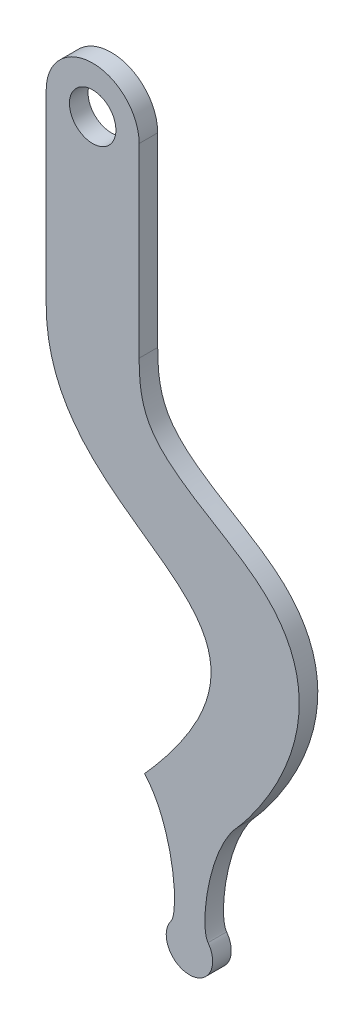
from build123d import *

# Parameters (mm, degrees)
CROQUIS1_R              = 0.25
SALIENTE_EXTRUIR1_DEPTH = 0.2


with BuildPart() as part:
    # Croquis1 → Saliente-Extruir1 (new body)
    with BuildSketch(Plane.XY):
        with BuildLine():
            Line((-0.953049545, -0.258041218), (-0.953049545, -2.258041218))
            add(Edge.make_bspline(
                [(-0.953049545, -2.258041218), (-0.953049545, -2.777596153), (-0.792723594, -3.039794493), (1.611557074, -4.393344835), (0.148079669, -6.054927281), (0.105412555, -6.100480554)],
                knots=[0, 0, 0, 0, 0.302759369, 0.402759369, 1, 1, 1, 1], degree=3))
            add(Edge.make_bspline(
                [(-0.211679745, -7.333949248), (-0.302912235, -7.212305928), (-0.211828565, -6.439181016), (0.105412555, -6.100480554)],
                knots=[0, 0, 0, 0, 1, 1, 1, 1], degree=3))
            ThreePointArc((-0.211679745, -7.333949248), (-0.411679745, -7.733949248), (-0.611679745, -7.333949248))
            add(Edge.make_bspline(
                [(-0.611679745, -7.333949248), (-0.51667907, -7.207281682), (-0.584931115, -6.434344759), (-0.894587445, -6.100480554)],
                knots=[0, 0, 0, 0, 1, 1, 1, 1], degree=3))
            add(Edge.make_bspline(
                [(-1.953049545, -2.258041218), (-1.953049545, -4.324497965), (1.193109737, -3.742015961), (-0.894587445, -6.100480554)],
                knots=[0, 0, 0, 0, 1, 1, 1, 1], degree=3))
            Line((-1.953049545, -2.258041218), (-1.953049545, -0.258041218))
            ThreePointArc((-1.953049545, -0.258041218), (-1.453049545, 0.241958782), (-0.953049545, -0.258041218))
        make_face()
        with Locations((-1.453049545, -0.258041218)):
            Circle(CROQUIS1_R, mode=Mode.SUBTRACT)
    extrude(amount=SALIENTE_EXTRUIR1_DEPTH)


solid = part.part
